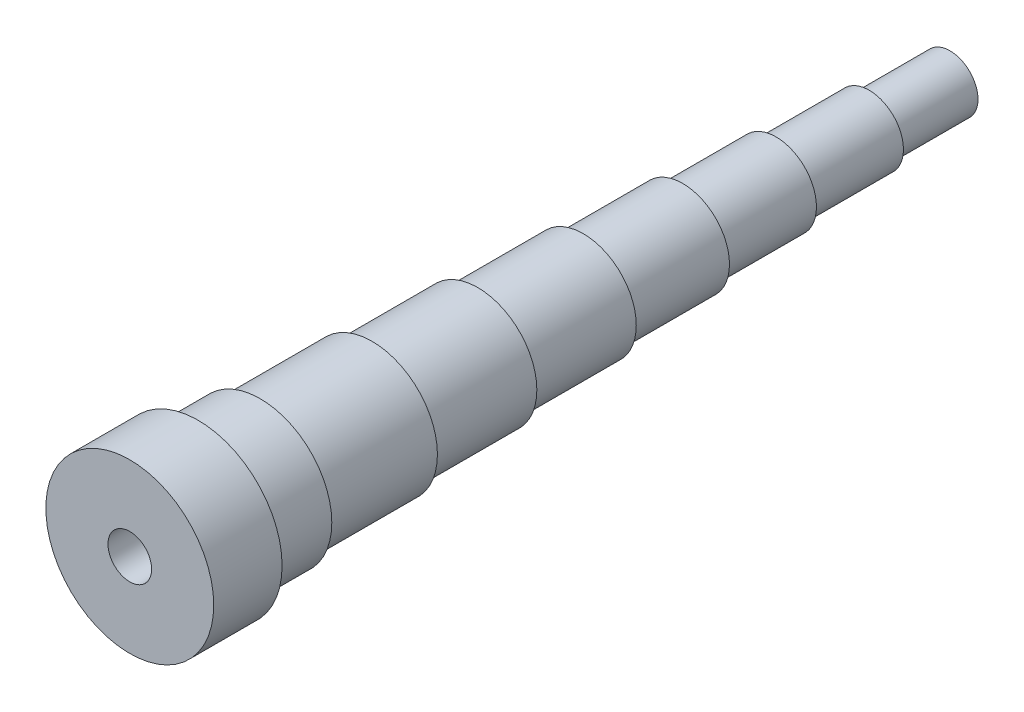
from build123d import *


with BuildPart() as part:
    # Sketch1 → Revolve1 (revolve)
    with BuildSketch(Plane(origin=(0, 0, 0), x_dir=(0, 0, -1), z_dir=(1, 0, 0)), mode=Mode.PRIVATE) as revolve1_sk:
        Polygon((-264.03808, 12.7), (213.40064, 12.7), (213.40064, 16.31696), (166.38016, 16.31696), (166.38016, 19.93392), (112.12576, 19.93392), (112.12576, 23.55088), (57.87136, 23.55088), (57.87136, 27.16784), (0, 27.16784), (0, 30.7848), (-61.48832, 30.7848), (-61.48832, 34.40176), (-122.97664, 34.40176), (-122.97664, 38.01872), (-188.08192, 38.01872), (-188.08192, 41.63568), (-224.25152, 41.63568), (-224.25152, 48.8696), (-264.03808, 48.8696), (-264.03808, 38.01872), align=None)
    revolve(revolve1_sk.sketch.rotate(Axis((0, 0, 19.904928919), (0, 0, -1)), 90), axis=Axis((0, 0, 19.904928919), (0, 0, -1)))


solid = part.part
